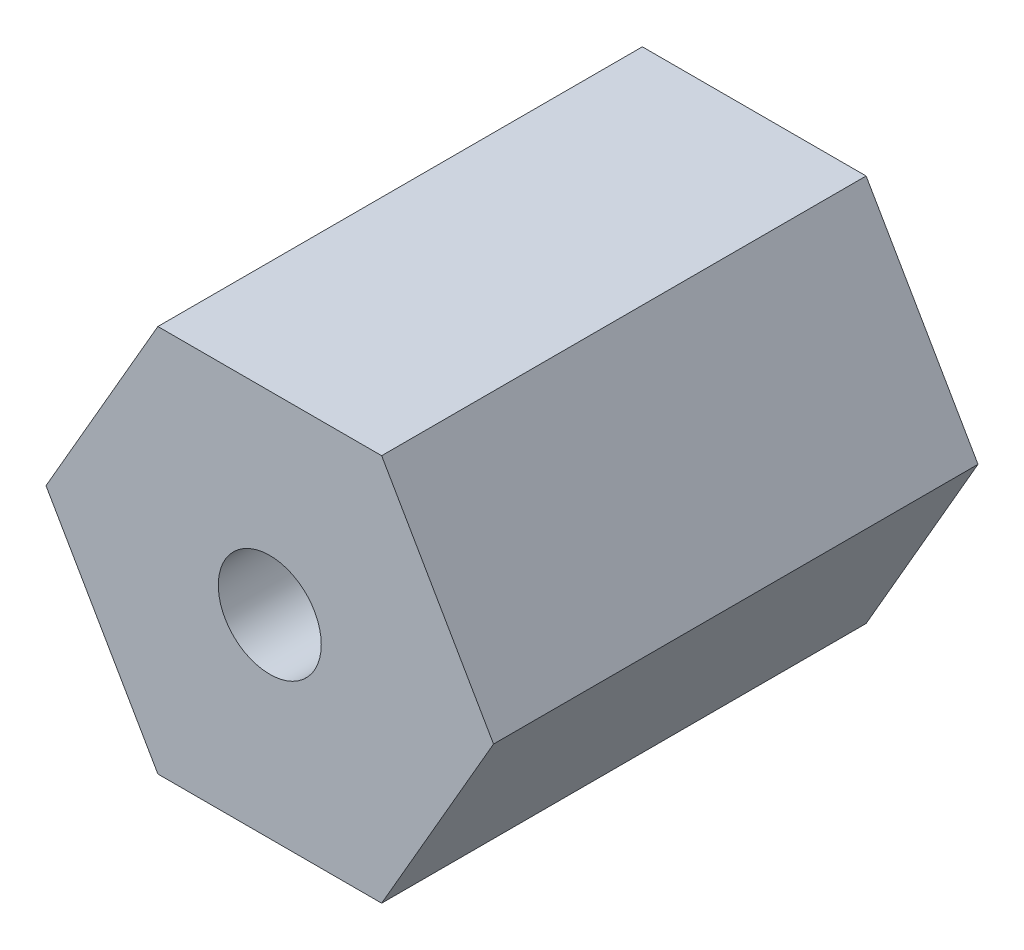
from build123d import *

# Parameters (mm, degrees)
SKETCH1_R             = 5.08
BOSS_EXTRUDE1_DEPTH   = 12.7
M3X0_5_TAPPED_HOLE1_D = 2.7


with BuildPart() as part:
    # Sketch1 → Boss-Extrude1 (new body)
    with BuildSketch(Plane.XY):
        Circle(SKETCH1_R)
        with BuildLine():
            Line((-2.932939367, 5.08), (-4.399409037, 2.540000024))
            ThreePointArc((-4.399409037, 2.540000024), (-2.539999988, 4.399409058), (0, 5.08))
            Line((0, 5.08), (-2.932939367, 5.08))
        make_face()
        with BuildLine():
            Line((2.932939367, 5.08), (0, 5.08))
            ThreePointArc((0, 5.08), (2.539999994, 4.399409055), (4.399409045, 2.540000012))
            Line((4.399409045, 2.540000012), (2.932939367, 5.08))
        make_face()
        with BuildLine():
            ThreePointArc((5.08, 0), (4.906903196, -1.314800756), (4.399409045, -2.540000012))
            Line((4.399409045, -2.540000012), (5.865878735, 0))
            Line((5.865878735, 0), (4.399409045, 2.540000012))
            ThreePointArc((4.399409045, 2.540000012), (4.906903196, 1.314800756), (5.08, 0))
        make_face()
        with BuildLine():
            ThreePointArc((4.399409045, -2.540000012), (2.539999994, -4.399409055), (0, -5.08))
            Line((0, -5.08), (2.932939367, -5.08))
            Line((2.932939367, -5.08), (4.399409045, -2.540000012))
        make_face()
        with BuildLine():
            Line((-4.399409037, 2.540000024), (-5.865878735, 0))
            Line((-5.865878735, 0), (-4.399409045, -2.540000012))
            ThreePointArc((-4.399409045, -2.540000012), (-5.08, 7e-09), (-4.399409037, 2.540000024))
        make_face()
        with BuildLine():
            ThreePointArc((0, -5.08), (-2.539999994, -4.399409055), (-4.399409045, -2.540000012))
            Line((-4.399409045, -2.540000012), (-2.932939367, -5.08))
            Line((-2.932939367, -5.08), (0, -5.08))
        make_face()
    extrude(amount=BOSS_EXTRUDE1_DEPTH)

    # M3x0.5 Tapped Hole1 (through all)
    with Locations(Plane.XY.offset(12.7)):
        with Locations((0, 0)):
            Hole(M3X0_5_TAPPED_HOLE1_D / 2)


solid = part.part
